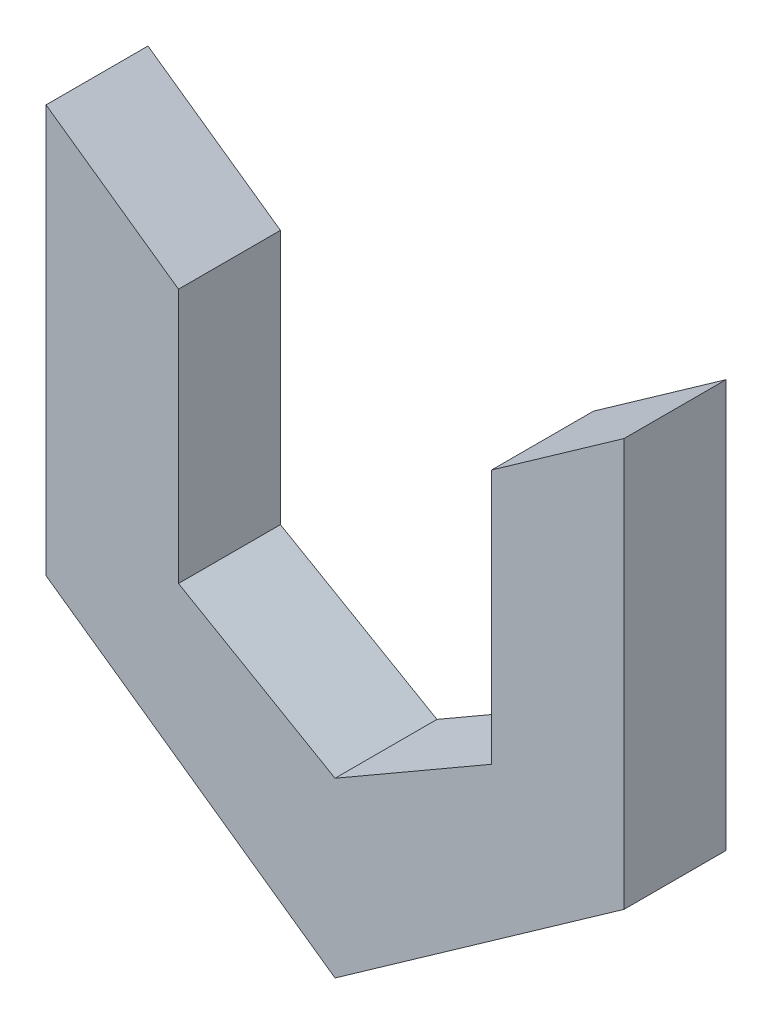
from build123d import *

# Parameters (mm, degrees)
EXTRUDE_1_DEPTH = 10


with BuildPart() as part:
    # 草图1 → 凸台-拉伸1 (new body)
    with BuildSketch(Plane.XY):
        Polygon((0, 0), (0, -40), (28.346110415, -60), (56.69222083, -40), (56.69222083, 0), (43.70222083, -9.165278629), (43.70222083, -34.165278629), (28.346110415, -43.031133111), (12.99, -34.165278629), (12.99, -9.165278629), align=None)
    extrude(amount=EXTRUDE_1_DEPTH)


solid = part.part
